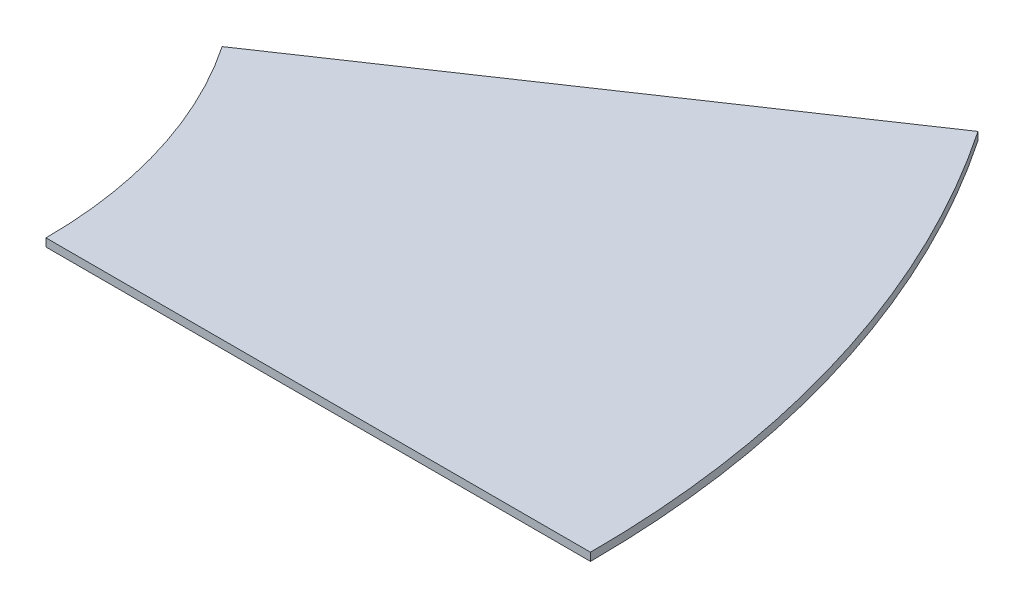
from build123d import *

# Parameters (mm, degrees)
EXTRUDE_1_DEPTH = 0.88


with BuildPart() as part:
    # 草图1 → 凸台-拉伸1 (new body)
    with BuildSketch(Plane(origin=(0, 0, 0), x_dir=(1, 0, 0), z_dir=(0, 1, 0))):
        with BuildLine():
            Line((91.194132981, 61.511219382), (41.451878628, 27.959645174))
            ThreePointArc((41.451878628, 27.959645174), (47.815237798, 14.618585236), (50, 0))
            Line((50, 0), (110, 0))
            ThreePointArc((110, 0), (105.193523156, 32.16088752), (91.194132981, 61.511219382))
        make_face()
    extrude(amount=EXTRUDE_1_DEPTH)


solid = part.part
